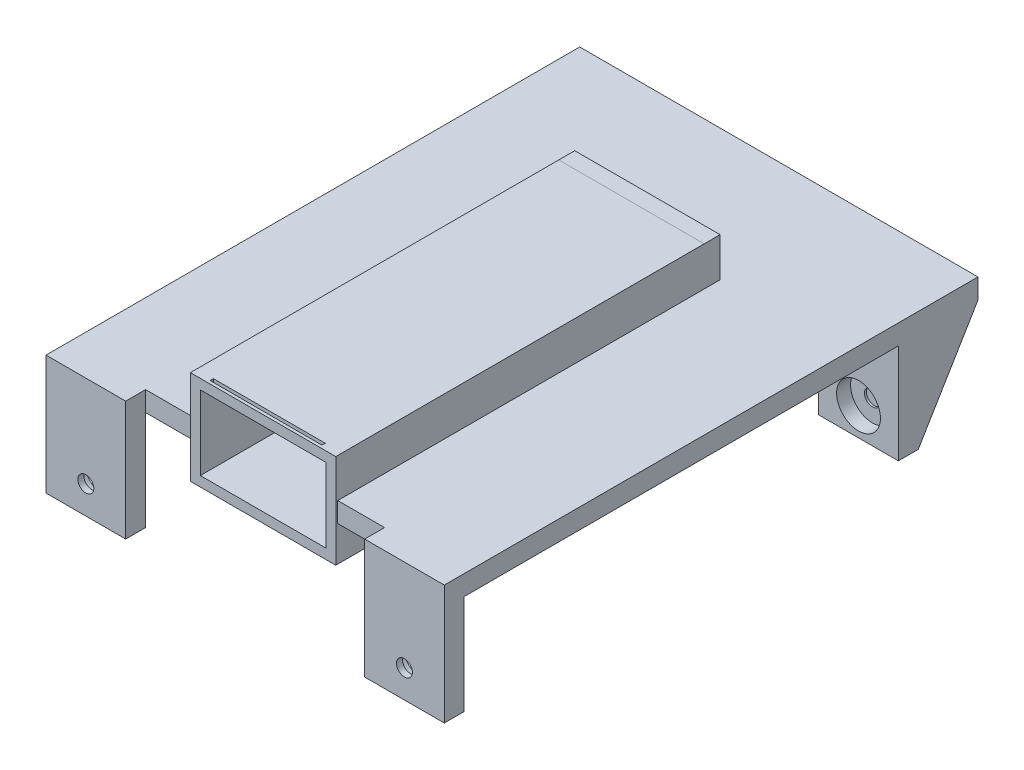
from build123d import *

# Parameters (mm, degrees)
SKETCH1_W                                  = 200
SKETCH1_H                                  = 258
BOSS_EXTRUDE1_DEPTH                        = 10
BOSS_EXTRUDE4_DEPTH                        = 40
SKETCH5_R                                  = 11
CUT_EXTRUDE2_DEPTH                         = 7
SKETCH6_W                                  = 200
SKETCH6_H                                  = 10
BOSS_EXTRUDE6_DEPTH                        = 60
SKETCH7_W                                  = 120
SKETCH7_H                                  = 60
CUT_EXTRUDE3_DEPTH                         = 10
MIRROR4_AT_THE_SECOND_PLANE_COPY_1_SKETC_R = 11
MIRROR4_AT_THE_SECOND_PLANE_COPY_1_DEPTH   = 7
SKETCH8_R                                  = 4
CUT_EXTRUDE4_DEPTH                         = 10
CUT_EXTRUDE6_START                         = -1
SKETCH9_R                                  = 4
CUT_EXTRUDE6_DEPTH                         = 1
SKETCH12_W                                 = 73
SKETCH12_H                                 = 47.27438
SKETCH12_W_2                               = 63
SKETCH12_H_2                               = 37.27438
BOSS_EXTRUDE8_DEPTH                        = 185
SKETCH14_W                                 = 63
SKETCH14_H                                 = 23.684822392
CUT_EXTRUDE7_DEPTH                         = 184
SKETCH15_W                                 = 73
SKETCH15_H                                 = 8
CUT_EXTRUDE8_DEPTH                         = 184
SKETCH16_W                                 = 73
SKETCH16_H                                 = 8
BOSS_EXTRUDE9_DEPTH                        = 47.27
SKETCH17_W                                 = 56.193521686
SKETCH17_H                                 = 1.65349891
CUT_EXTRUDE9_DEPTH                         = 7.27


with BuildPart() as part:
    # Sketch1 → Boss-Extrude1 (new body)
    with BuildSketch(Plane(origin=(0, 0, 0), x_dir=(1, 0, 0), z_dir=(0, 1, 0))):
        Rectangle(SKETCH1_W, SKETCH1_H)
    extrude(amount=BOSS_EXTRUDE1_DEPTH)

    # Sketch2 → Boss-Extrude4 (add)
    with BuildSketch(Plane(origin=(100, 0, 0), x_dir=(0, 0, -1), z_dir=(1, 0, 0))):
        Polygon((89, 0), (89, -50), (99, -50), (129, 0), align=None)
    boss_extrude4 = extrude(amount=-BOSS_EXTRUDE4_DEPTH)

    # Sketch5 → Cut-Extrude2 (cut)
    with BuildSketch(Plane.XY.offset(-89)):
        with Locations((80, -36)):
            Circle(SKETCH5_R)
    cut_extrude2 = extrude(amount=-CUT_EXTRUDE2_DEPTH, mode=Mode.SUBTRACT)

    # Mirror3: Boss-Extrude4, Cut-Extrude2 across plane
    add(boss_extrude4.mirror(Plane(origin=(0, 0, 0), x_dir=(0, 0, 1), z_dir=(1, 0, 0))))
    add(cut_extrude2.mirror(Plane(origin=(0, 0, 0), x_dir=(0, 0, 1), z_dir=(1, 0, 0))), mode=Mode.SUBTRACT)

    # Sketch6 → Boss-Extrude6 (add)
    with BuildSketch(Plane(origin=(0, 10, 0), x_dir=(1, 0, 0), z_dir=(0, 1, 0))):
        with Locations((0, -134)):
            Rectangle(SKETCH6_W, SKETCH6_H)
    extrude(amount=-BOSS_EXTRUDE6_DEPTH)

    # Sketch7 → Cut-Extrude3 (cut)
    with BuildSketch(Plane.XY.offset(139)):
        with Locations((0, -20)):
            Rectangle(SKETCH7_W, SKETCH7_H)
    extrude(amount=-CUT_EXTRUDE3_DEPTH, mode=Mode.SUBTRACT)

    # Mirror4: Cut-Extrude2 across plane
    add(cut_extrude2.mirror(Plane(origin=(0, 0, 0), x_dir=(0, 0, 1), z_dir=(1, 0, 0))), mode=Mode.SUBTRACT)

    # Mirror4 at the second plane: Cut-Extrude2 across plane
    add(cut_extrude2.mirror(Plane.XY.offset(20)), mode=Mode.SUBTRACT)

    # Mirror4 at the second plane copy 1 sketc → Mirror4 at the second plane copy 1 (cut)
    with BuildSketch(Plane(origin=(0, 0, 129), x_dir=(-1, 0, 0), z_dir=(0, 0, -1))):
        with Locations((80, -36)):
            Circle(MIRROR4_AT_THE_SECOND_PLANE_COPY_1_SKETC_R)
    extrude(amount=-MIRROR4_AT_THE_SECOND_PLANE_COPY_1_DEPTH, mode=Mode.SUBTRACT)

    # Sketch8 → Cut-Extrude4 (cut)
    with BuildSketch(Plane(origin=(0, 0, 136), x_dir=(-1, 0, 0), z_dir=(0, 0, -1))):
        with Locations((-80, -36)):
            Circle(SKETCH8_R)
    cut_extrude4 = extrude(amount=-CUT_EXTRUDE4_DEPTH, mode=Mode.SUBTRACT)

    # Mirror5: Cut-Extrude4 across plane
    add(cut_extrude4.mirror(Plane(origin=(0, 0, 0), x_dir=(0, 0, 1), z_dir=(1, 0, 0))), mode=Mode.SUBTRACT)

    # Sketch9 → Cut-Extrude6 (cut)
    with BuildSketch(Plane.XY.offset(-96).offset(CUT_EXTRUDE6_START)):
        with Locations((-80, -36)):
            Circle(SKETCH9_R)
    cut_extrude6 = extrude(amount=CUT_EXTRUDE6_DEPTH, mode=Mode.SUBTRACT)

    # Mirror6: Cut-Extrude6 across plane
    add(cut_extrude6.mirror(Plane(origin=(0, 0, 0), x_dir=(0, 0, 1), z_dir=(1, 0, 0))), mode=Mode.SUBTRACT)

    # Sketch14 → Cut-Extrude7 (cut)
    with BuildSketch(Plane.XY.offset(129)):
        Rectangle(SKETCH14_W, SKETCH14_H)
    extrude(amount=-CUT_EXTRUDE7_DEPTH, mode=Mode.SUBTRACT)

    # Sketch15 → Cut-Extrude8 (cut)
    with BuildSketch(Plane(origin=(0, -17.63719, 0), x_dir=(-1, 0, 0), z_dir=(0, -1, 0))):
        with Locations((0, 59)):
            Rectangle(SKETCH15_W, SKETCH15_H)
    extrude(amount=-CUT_EXTRUDE8_DEPTH, mode=Mode.SUBTRACT)



with BuildPart() as body_2:
    # Sketch12 → Boss-Extrude8 (new body)
    with BuildSketch(Plane.XY.offset(130)):
        with Locations((0, 6)):
            Rectangle(SKETCH12_W, SKETCH12_H)
        with Locations((0, 6)):
            Rectangle(SKETCH12_W_2, SKETCH12_H_2, mode=Mode.SUBTRACT)
    extrude(amount=-BOSS_EXTRUDE8_DEPTH)


with BuildPart() as part_1:
    add(part.part)

    add(body_2.part)  # Boss-Extrude9 merges body 2
    # Sketch16 → Boss-Extrude9 (add)
    with BuildSketch(Plane(origin=(0, -17.63719, 0), x_dir=(-1, 0, 0), z_dir=(0, -1, 0))):
        with Locations((0, 59)):
            Rectangle(SKETCH16_W, SKETCH16_H)
    extrude(amount=-BOSS_EXTRUDE9_DEPTH)

    # Sketch17 → Cut-Extrude9 (cut)
    with BuildSketch(Plane(origin=(0, 29.63719, 0), x_dir=(1, 0, 0), z_dir=(0, 1, 0))):
        with Locations((0, -127.668994325)):
            Rectangle(SKETCH17_W, SKETCH17_H)
    extrude(amount=-CUT_EXTRUDE9_DEPTH, mode=Mode.SUBTRACT)


solid = part_1.part
